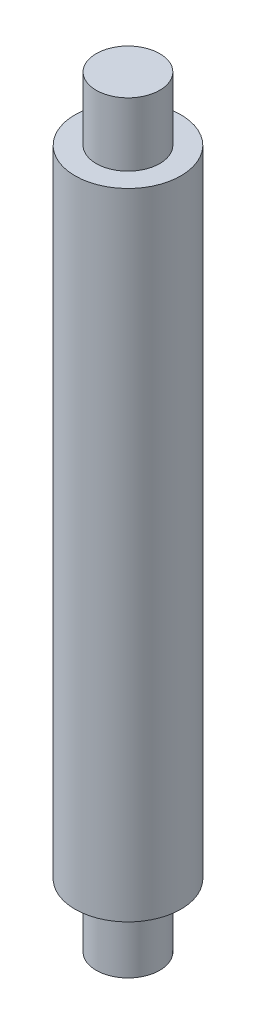
from build123d import *

# Parameters (mm, degrees)
SKETCH_1_R      = 2.5
EXTRUDE_2_DEPTH = 15
SKETCH_2_R      = 1.5
EXTRUDE_3_DEPTH = 3
EXTRUDE_START   = 3
SKETCH_3_R      = 1.5
EXTRUDE_4_DEPTH = 3


with BuildPart() as part:
    # 草图1 → 凸台-拉伸2 (new, symmetric)
    with BuildSketch(Plane(origin=(0, 0, 0), x_dir=(1, 0, 0), z_dir=(0, 1, 0))):
        with Locations(Location((0, 0, 0), (0, 0, 270))):
            Circle(SKETCH_1_R)
    extrude(amount=EXTRUDE_2_DEPTH, both=True)

    # 草图2 → 凸台-拉伸3 (add)
    with BuildSketch(Plane(origin=(0, 15, 0), x_dir=(1, 0, 0), z_dir=(0, 1, 0))):
        with Locations(Location((0, 0, 0), (0, 0, 270))):
            Circle(SKETCH_2_R)
    extrude(amount=EXTRUDE_3_DEPTH)

    # 草图3 → 凸台-拉伸4 (add)
    with BuildSketch(Plane.XZ.offset(15).offset(EXTRUDE_START)):
        with Locations(Location((0, 0, 0), (0, 0, 90))):
            Circle(SKETCH_3_R)
    extrude(amount=-EXTRUDE_4_DEPTH)


solid = part.part
